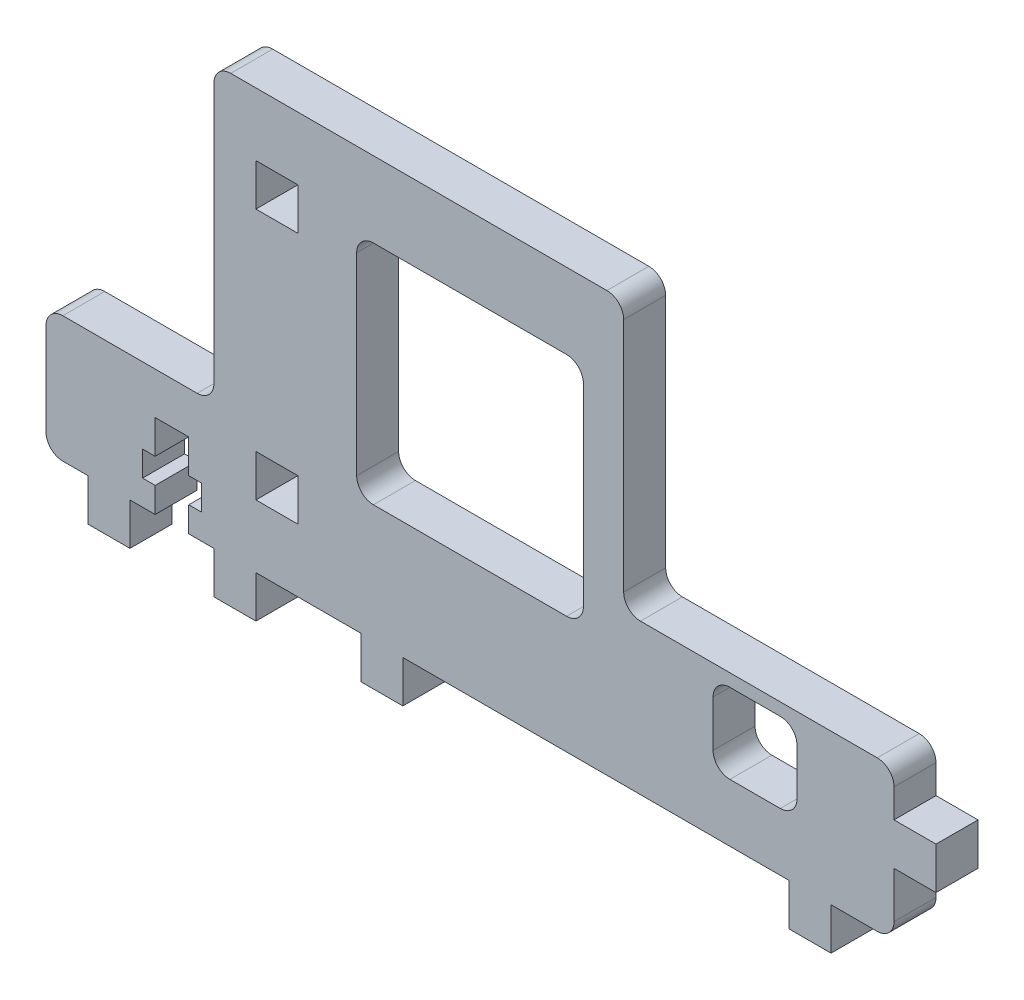
from build123d import *

# Parameters (mm, degrees)
ESQUISSE1_W        = 27
ESQUISSE1_H        = 27
ESQUISSE1_W_2      = 5
ESQUISSE1_H_2      = 5
ESQUISSE1_W_3      = 10
ESQUISSE1_H_3      = 9.5
BOSS_EXTRU_1_DEPTH = 5
CONG_1_R           = 2


with BuildPart() as part:
    # Esquisse1 → Boss.-Extru.1 (new body)
    with BuildSketch(Plane.XY):
        Polygon((0, 0), (7.5, 0), (7.5, -5), (12.5, -5), (12.5, 0), (58.5, 0), (58.5, -5), (63.5, -5), (63.5, 0), (71, 0), (71, 7.5), (76, 7.5), (76, 12.5), (71, 12.5), (71, 17.9), (38.8, 17.9), (38.8, 50), (-10, 50), (-10, 15), (-30, 15), (-30, 0), (-25, 0), (-25, -5), (-20, -5), (-20, 0), (-17, 0), (-17, 3), (-18.5, 3), (-18.5, 6), (-17, 6), (-17, 10), (-13, 10), (-13, 6), (-11.5, 6), (-11.5, 3), (-13, 3), (-13, 0), (-10, 0), (-10, -5), (-5, -5), (-5, 0), align=None)
        with Locations((20.5, 27.5)):
            Rectangle(ESQUISSE1_W, ESQUISSE1_H, mode=Mode.SUBTRACT)
        with Locations((-2.5, 40)):
            Rectangle(ESQUISSE1_W_2, ESQUISSE1_H_2, mode=Mode.SUBTRACT)
        with Locations((-2.5, 10)):
            Rectangle(ESQUISSE1_W_2, ESQUISSE1_H_2, mode=Mode.SUBTRACT)
        with Locations((54.45, 11.65)):
            Rectangle(ESQUISSE1_W_3, ESQUISSE1_H_3, mode=Mode.SUBTRACT)
    extrude(amount=BOSS_EXTRU_1_DEPTH)

    # Congé1
    cong_1_edges = [part.edges().sort_by_distance(p)[0] for p in [
        (7, 41, 2.5),
        (7, 14, 2.5),
        (34, 14, 2.5),
        (34, 41, 2.5),
        (49.45, 16.4, 2.5),
        (49.45, 6.9, 2.5),
        (59.45, 6.9, 2.5),
        (59.45, 16.4, 2.5),
        (-30, 0, 2.5),
        (-30, 15, 2.5),
        (-10, 15, 2.5),
        (-10, 50, 2.5),
        (38.8, 50, 2.5),
        (38.8, 17.9, 2.5),
        (71, 17.9, 2.5),
        (71, 0, 2.5),
    ]]
    fillet(cong_1_edges, radius=CONG_1_R)


solid = part.part
